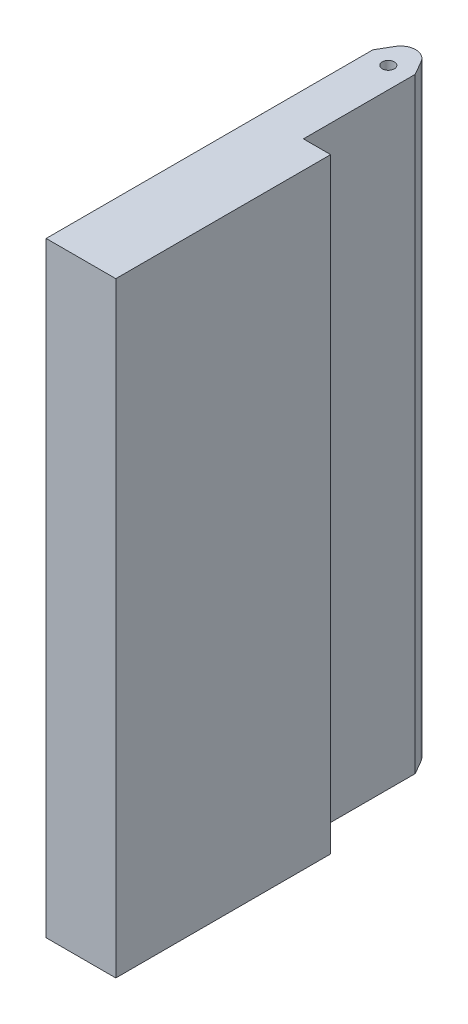
from build123d import *

# Parameters (mm, degrees)
SKETCH1_W           = 22
SKETCH1_H           = 120
BOSS_EXTRUDE1_DEPTH = 200
SKETCH2_OUTSIDE_W   = 70.854
SKETCH2_OUTSIDE_H   = 168.854
CUT_EXTRUDE1_DEPTH  = 210.095671883
FILLET1_R           = 5
CUT_EXTRUDE2_DEPTH  = 210.095671883
SKETCH4_W           = 96.947441117
SKETCH4_H           = 200
BOSS_EXTRUDE2_DEPTH = 5
SKETCH5_W           = 4
SKETCH5_H           = 96.947441117
CUT_EXTRUDE3_DEPTH  = 210.418241803
SKETCH6_R           = 2
CUT_EXTRUDE4_DEPTH  = 210.418241803
SKETCH8_W           = 9
SKETCH8_H           = 26
CUT_EXTRUDE5_DEPTH  = 210.418241803


with BuildPart() as part:
    # Sketch1 → Boss-Extrude1 (new body)
    with BuildSketch(Plane(origin=(0, 0, 0), x_dir=(1, 0, 0), z_dir=(0, 1, 0))):
        Rectangle(SKETCH1_W, SKETCH1_H)
    extrude(amount=BOSS_EXTRUDE1_DEPTH)

    # Sketch2 outside → Cut-Extrude1 (cut, through all)
    with BuildSketch(Plane(origin=(0, 200, 0), x_dir=(1, 0, 0), z_dir=(0, 1, 0))):
        Rectangle(SKETCH2_OUTSIDE_W, SKETCH2_OUTSIDE_H)
        Polygon((0, 60), (-11, 40.947441117), (-11, -60), (11, -60), (11, 40.947441117), align=None, mode=Mode.SUBTRACT)
    extrude(amount=-CUT_EXTRUDE1_DEPTH, mode=Mode.SUBTRACT)

    # Fillet1
    fillet1_edges = [part.edges().sort_by_distance(p)[0] for p in [
        (0, 100, -60),
    ]]
    fillet(fillet1_edges, radius=FILLET1_R)

    # Sketch3 → Cut-Extrude2 (cut, through all)
    with BuildSketch(Plane(origin=(0, 200, 0), x_dir=(1, 0, 0), z_dir=(0, 1, 0))):
        Polygon((-11, 36.947441117), (-7, 36.947441117), (-7, 47.875644347), (-11, 40.947441117), align=None)
        Polygon((7, 47.875644347), (11, 40.947441117), (11, 36.947441117), (7, 36.947441117), align=None)
    extrude(amount=-CUT_EXTRUDE2_DEPTH, mode=Mode.SUBTRACT)

    # Sketch4 → Boss-Extrude2 (add)
    with BuildSketch(Plane(origin=(11, 0, 0), x_dir=(0, 0, -1), z_dir=(1, 0, 0))):
        with Locations((-11.526279442, 100)):
            Rectangle(SKETCH4_W, SKETCH4_H)
    extrude(amount=BOSS_EXTRUDE2_DEPTH)

    # Sketch5 → Cut-Extrude3 (cut, through all)
    with BuildSketch(Plane(origin=(0, 200, 0), x_dir=(1, 0, 0), z_dir=(0, 1, 0))):
        with Locations((-9, -11.526279442)):
            Rectangle(SKETCH5_W, SKETCH5_H)
    extrude(amount=-CUT_EXTRUDE3_DEPTH, mode=Mode.SUBTRACT)

    # Sketch6 → Cut-Extrude4 (cut, through all)
    with BuildSketch(Plane(origin=(0, 200, 0), x_dir=(1, 0, 0), z_dir=(0, 1, 0))):
        with Locations(Location((0, 46, 0), (0, 0, 270))):
            Circle(SKETCH6_R)
    extrude(amount=-CUT_EXTRUDE4_DEPTH, mode=Mode.SUBTRACT)

    # Sketch8 → Cut-Extrude5 (cut, through all)
    with BuildSketch(Plane(origin=(0, 200, 0), x_dir=(1, 0, 0), z_dir=(0, 1, 0))):
        with Locations((11.5, 23.947441117)):
            Rectangle(SKETCH8_W, SKETCH8_H)
    extrude(amount=-CUT_EXTRUDE5_DEPTH, mode=Mode.SUBTRACT)


solid = part.part
